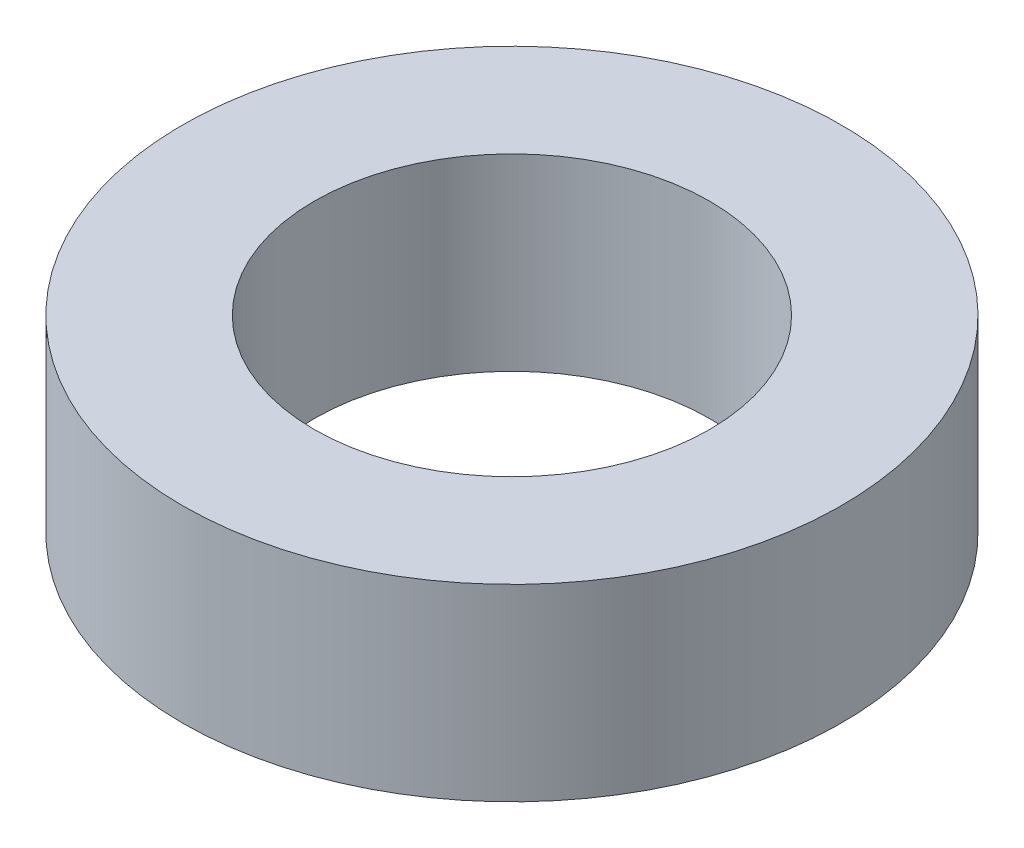
from build123d import *

# Parameters (mm, degrees)
SKETCH1_R           = 3.5
SKETCH1_R_2         = 2.1
BOSS_EXTRUDE1_DEPTH = 2


with BuildPart() as part:
    # Sketch1 → Boss-Extrude1 (new body)
    with BuildSketch(Plane(origin=(0, 0, 0), x_dir=(1, 0, 0), z_dir=(0, 1, 0))):
        with Locations(Location((0, 0, 0), (0, 0, 270))):
            Circle(SKETCH1_R)
        with Locations(Location((0, 0, 0), (0, 0, 270))):
            Circle(SKETCH1_R_2, mode=Mode.SUBTRACT)
    extrude(amount=BOSS_EXTRUDE1_DEPTH)


solid = part.part
